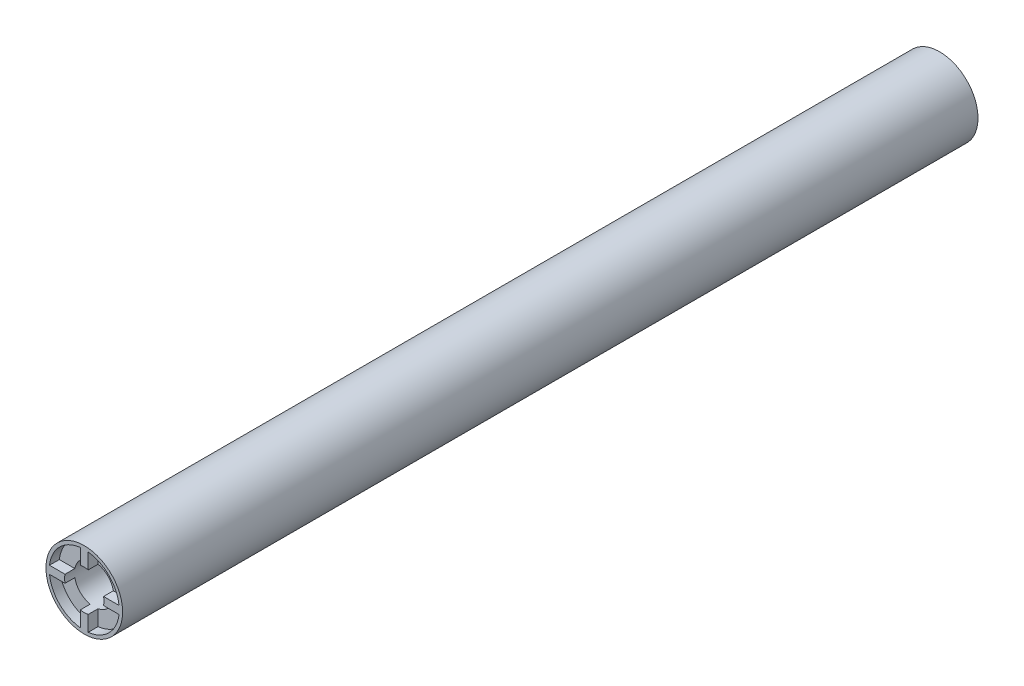
from build123d import *

# Parameters (mm, degrees)
SKETCH_1_R          = 1.95
EXTRUDE_1_DEPTH     = 43
SKETCH_3_R          = 1
CUT_EXTRUDE_1_DEPTH = 8
EXTRUDE_START       = 0.5
EXTRUDE_3_DEPTH     = 0.5


with BuildPart() as part:
    # 草图1 → 凸台-拉伸1 (new body)
    with BuildSketch(Plane.XY):
        Circle(SKETCH_1_R)
    extrude(amount=-EXTRUDE_1_DEPTH)

    # 草图3 → 切除-拉伸1 (cut)
    with BuildSketch(Plane.XY):
        Circle(SKETCH_3_R)
    extrude(amount=-CUT_EXTRUDE_1_DEPTH, mode=Mode.SUBTRACT)

    # 草图4 → 凸台-拉伸3 (add)
    with BuildSketch(Plane.XY.offset(EXTRUDE_START)):
        with BuildLine():
            Line((-1.768728357, 0.2), (-1.939716474, 0.2))
            ThreePointArc((-1.939716474, 0.2), (-1.95, 0), (-1.939716474, -0.2))
            Line((-1.939716474, -0.2), (-1.768728357, -0.2))
            ThreePointArc((-1.768728357, -0.2), (-1.78, 0), (-1.768728357, 0.2))
        make_face()
        with BuildLine():
            ThreePointArc((1.95, 0), (1.947427422, 0.100132101), (1.939716474, 0.2))
            Line((1.939716474, 0.2), (1.768728357, 0.2))
            ThreePointArc((1.768728357, 0.2), (1.777179855, 0.100158687), (1.78, 0))
            ThreePointArc((1.78, 0), (1.777179855, -0.100158687), (1.768728357, -0.2))
            Line((1.768728357, -0.2), (1.939716474, -0.2))
            ThreePointArc((1.939716474, -0.2), (1.947427422, -0.100132101), (1.95, 0))
        make_face()
        with BuildLine():
            Line((0.2, -1.768728357), (0.2, -1.939716474))
            ThreePointArc((0.2, -1.939716474), (1.378858223, -1.378858223), (1.939716474, -0.2))
            Line((1.939716474, -0.2), (1.768728357, -0.2))
            ThreePointArc((1.768728357, -0.2), (1.258650071, -1.258650071), (0.2, -1.768728357))
        make_face()
        with BuildLine():
            Line((-0.2, -1.768728357), (-0.2, -1.939716474))
            ThreePointArc((-0.2, -1.939716474), (0, -1.95), (0.2, -1.939716474))
            Line((0.2, -1.939716474), (0.2, -1.768728357))
            ThreePointArc((0.2, -1.768728357), (0, -1.78), (-0.2, -1.768728357))
        make_face()
        with BuildLine():
            Line((-1.768728357, -0.2), (-1.939716474, -0.2))
            ThreePointArc((-1.939716474, -0.2), (-1.378858223, -1.378858223), (-0.2, -1.939716474))
            Line((-0.2, -1.939716474), (-0.2, -1.768728357))
            ThreePointArc((-0.2, -1.768728357), (-1.258650071, -1.258650071), (-1.768728357, -0.2))
        make_face()
        with BuildLine():
            ThreePointArc((-0.2, 1.939716474), (-1.378858223, 1.378858223), (-1.939716474, 0.2))
            Line((-1.939716474, 0.2), (-1.768728357, 0.2))
            ThreePointArc((-1.768728357, 0.2), (-1.258650071, 1.258650071), (-0.2, 1.768728357))
            Line((-0.2, 1.768728357), (-0.2, 1.939716474))
        make_face()
        with BuildLine():
            ThreePointArc((1.939716474, 0.2), (1.378858223, 1.378858223), (0.2, 1.939716474))
            Line((0.2, 1.939716474), (0.2, 1.768728357))
            ThreePointArc((0.2, 1.768728357), (1.258650071, 1.258650071), (1.768728357, 0.2))
            Line((1.768728357, 0.2), (1.939716474, 0.2))
        make_face()
        with BuildLine():
            ThreePointArc((0.2, 1.939716474), (0, 1.95), (-0.2, 1.939716474))
            Line((-0.2, 1.939716474), (-0.2, 1.768728357))
            ThreePointArc((-0.2, 1.768728357), (0, 1.78), (0.2, 1.768728357))
            Line((0.2, 1.768728357), (0.2, 1.939716474))
        make_face()
        with BuildLine():
            Line((-0.979795897, 0.2), (-1.768728357, 0.2))
            ThreePointArc((-1.768728357, 0.2), (-1.78, 0), (-1.768728357, -0.2))
            Line((-1.768728357, -0.2), (-0.979795897, -0.2))
            ThreePointArc((-0.979795897, -0.2), (-1, 0), (-0.979795897, 0.2))
        make_face()
        with BuildLine():
            ThreePointArc((1.78, 0), (1.777179855, 0.100158687), (1.768728357, 0.2))
            Line((1.768728357, 0.2), (0.979795897, 0.2))
            ThreePointArc((0.979795897, 0.2), (0.994936153, 0.100508962), (1, 0))
            ThreePointArc((1, 0), (0.994936153, -0.100508962), (0.979795897, -0.2))
            Line((0.979795897, -0.2), (1.768728357, -0.2))
            ThreePointArc((1.768728357, -0.2), (1.777179855, -0.100158687), (1.78, 0))
        make_face()
        with BuildLine():
            ThreePointArc((0.2, 1.768728357), (0, 1.78), (-0.2, 1.768728357))
            Line((-0.2, 1.768728357), (-0.2, 0.979795897))
            ThreePointArc((-0.2, 0.979795897), (0, 1), (0.2, 0.979795897))
            Line((0.2, 0.979795897), (0.2, 1.768728357))
        make_face()
        with BuildLine():
            Line((-0.2, -0.979795897), (-0.2, -1.768728357))
            ThreePointArc((-0.2, -1.768728357), (0, -1.78), (0.2, -1.768728357))
            Line((0.2, -1.768728357), (0.2, -0.979795897))
            ThreePointArc((0.2, -0.979795897), (0, -1), (-0.2, -0.979795897))
        make_face()
    extrude(amount=-EXTRUDE_3_DEPTH)


solid = part.part
